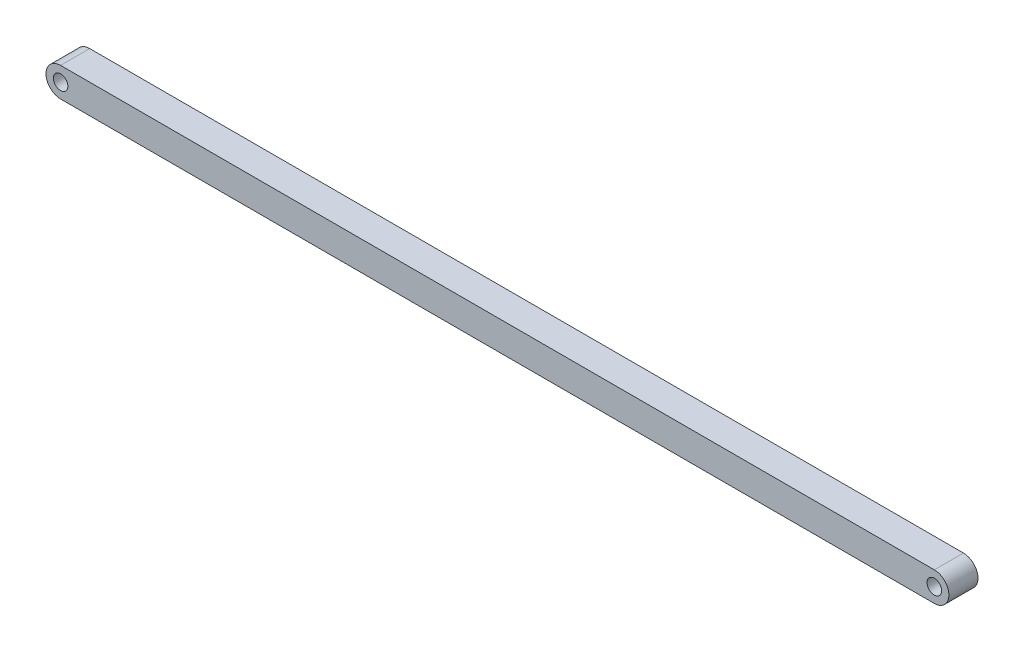
from build123d import *

# Parameters (mm, degrees)
SKETCH1_R           = 1.25
BOSS_EXTRUDE1_DEPTH = 5


with BuildPart() as part:
    # Sketch1 → Boss-Extrude1 (new body)
    with BuildSketch(Plane.XY):
        with BuildLine():
            Line((-75, 2.5), (75, 2.5))
            ThreePointArc((75, 2.5), (77.5, 0), (75, -2.5))
            Line((75, -2.5), (-75, -2.5))
            ThreePointArc((-75, -2.5), (-77.5, 0), (-75, 2.5))
        make_face()
        with Locations((-75, 0)):
            Circle(SKETCH1_R, mode=Mode.SUBTRACT)
        with Locations((75, 0)):
            Circle(SKETCH1_R, mode=Mode.SUBTRACT)
    extrude(amount=BOSS_EXTRUDE1_DEPTH)


solid = part.part
